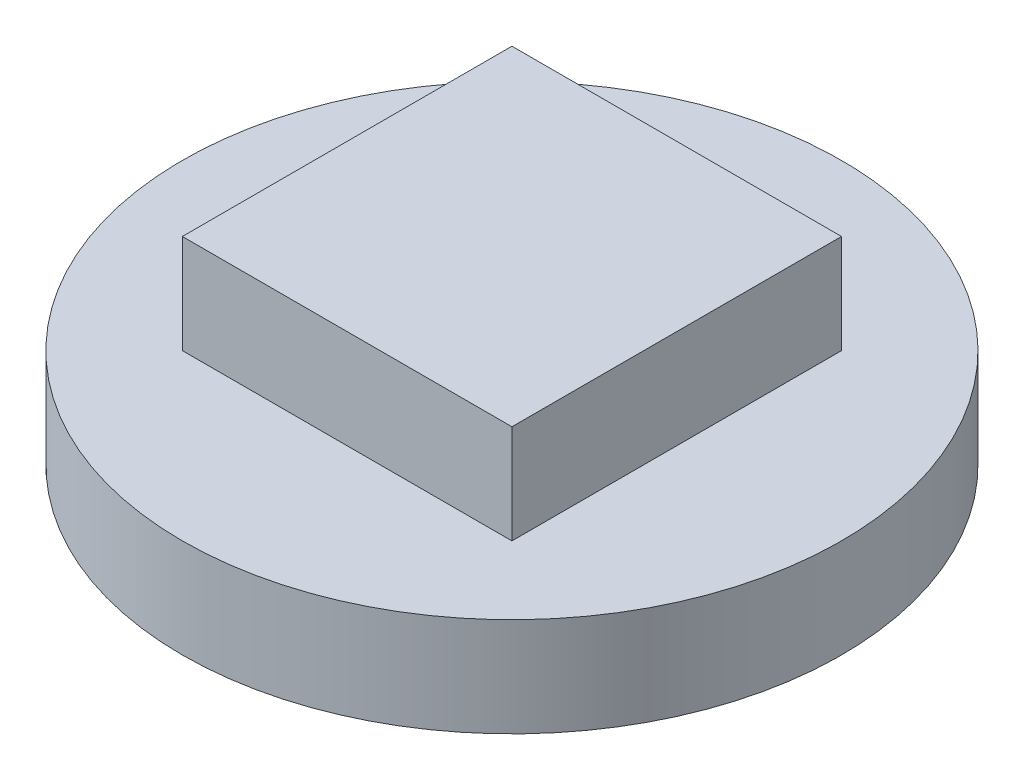
from build123d import *

# Parameters (mm, degrees)
SKETCH_1_R      = 5
EXTRUDE_1_DEPTH = 1.5
SKETCH_2_W      = 5
SKETCH_2_H      = 5
EXTRUDE_2_DEPTH = 3


with BuildPart() as part:
    # Эскиз1 → Бобышка-Вытянуть1 (new body)
    with BuildSketch(Plane(origin=(0, 0, 0), x_dir=(1, 0, 0), z_dir=(0, 1, 0))):
        with Locations(Location((0, 0, 0), (0, 0, 270))):
            Circle(SKETCH_1_R)
    extrude(amount=EXTRUDE_1_DEPTH)

    # Эскиз2 → Бобышка-Вытянуть2 (add)
    with BuildSketch(Plane(origin=(0, 0, 0), x_dir=(1, 0, 0), z_dir=(0, 1, 0))):
        Rectangle(SKETCH_2_W, SKETCH_2_H)
    extrude(amount=EXTRUDE_2_DEPTH)


solid = part.part
